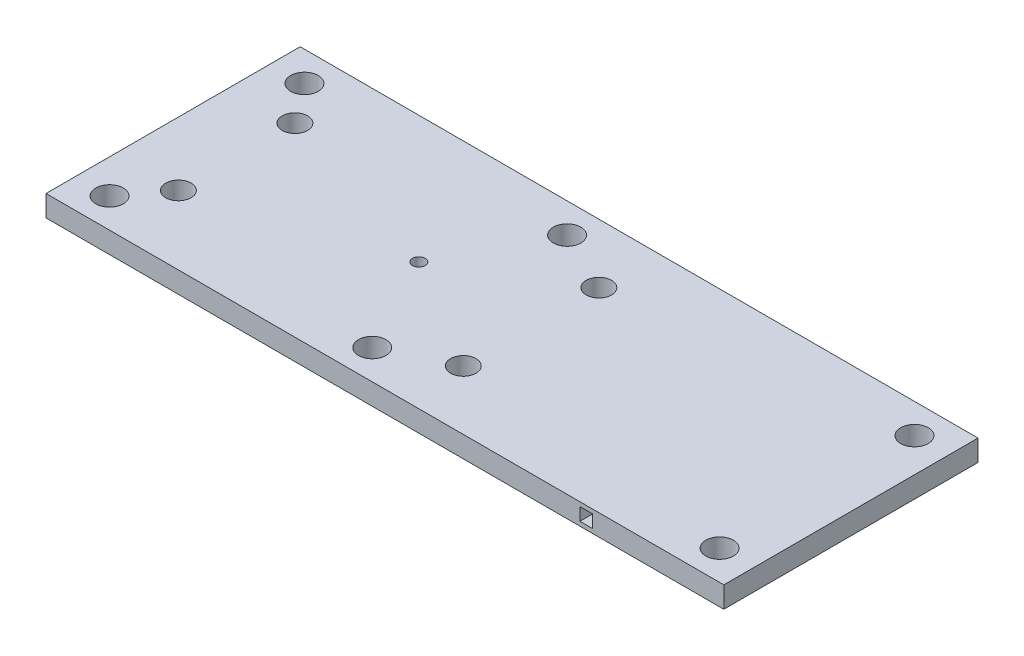
from build123d import *

# Parameters (mm, degrees)
SKETCH1_W           = 160
SKETCH1_H           = 60
SKETCH1_R           = 3.25
SKETCH1_R_2         = 3
SKETCH1_R_3         = 1.5
BOSS_EXTRUDE1_DEPTH = 5
SKETCH2_W           = 3
SKETCH2_H           = 3
CUT_1EXTRUDE1_DEPTH = 65


with BuildPart() as part:
    # Sketch1 → Boss-Extrude1 (new body)
    with BuildSketch(Plane(origin=(0, 0, 0), x_dir=(1, 0, 0), z_dir=(0, 1, 0))):
        Rectangle(SKETCH1_W, SKETCH1_H)
        with Locations(Location((-72, 23, 0), (0, 0, 270))):
            Circle(SKETCH1_R, mode=Mode.SUBTRACT)
        with Locations(Location((-72, -23, 0), (0, 0, 270))):
            Circle(SKETCH1_R, mode=Mode.SUBTRACT)
        with Locations(Location((72, 23, 0), (0, 0, 270))):
            Circle(SKETCH1_R, mode=Mode.SUBTRACT)
        with Locations(Location((72, -23, 0), (0, 0, 270))):
            Circle(SKETCH1_R, mode=Mode.SUBTRACT)
        with Locations(Location((-10, 23, 0), (0, 0, 270))):
            Circle(SKETCH1_R, mode=Mode.SUBTRACT)
        with Locations(Location((-10, -23, 0), (0, 0, 270))):
            Circle(SKETCH1_R, mode=Mode.SUBTRACT)
        with Locations(Location((4.5, 16, 0), (0, 0, 270))):
            Circle(SKETCH1_R_2, mode=Mode.SUBTRACT)
        with Locations(Location((4.5, -16, 0), (0, 0, 270))):
            Circle(SKETCH1_R_2, mode=Mode.SUBTRACT)
        with Locations(Location((-65, 13.75, 0), (0, 0, 270))):
            Circle(SKETCH1_R_2, mode=Mode.SUBTRACT)
        with Locations(Location((-65, -13.75, 0), (0, 0, 270))):
            Circle(SKETCH1_R_2, mode=Mode.SUBTRACT)
        with Locations(Location((-22, 0, 0), (0, 0, 270))):
            Circle(SKETCH1_R_3, mode=Mode.SUBTRACT)
    extrude(amount=BOSS_EXTRUDE1_DEPTH)

    # Sketch2 → Cut-1Extrude1 (cut)
    with BuildSketch(Plane.XY.offset(30)):
        with Locations((47.530607127, 2.5)):
            Rectangle(SKETCH2_W, SKETCH2_H)
    extrude(amount=-CUT_1EXTRUDE1_DEPTH, mode=Mode.SUBTRACT)


solid = part.part
